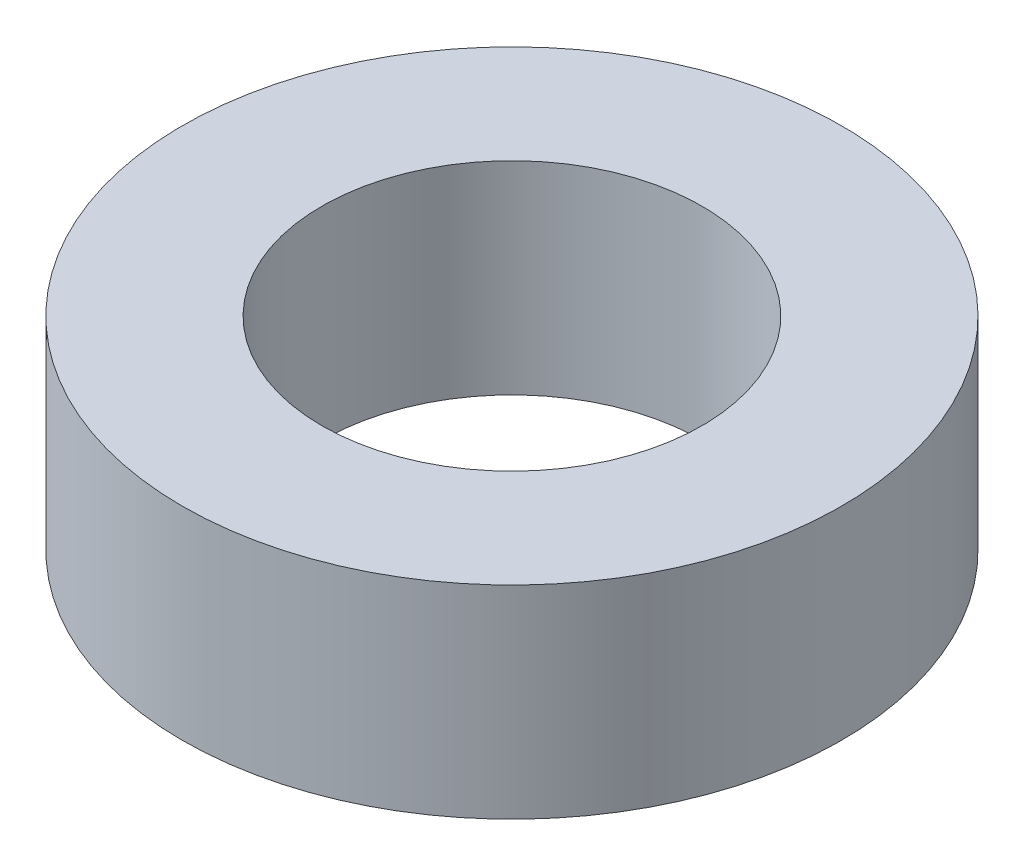
from build123d import *

# Parameters (mm, degrees)
SKETCH1_R           = 26
SKETCH1_R_2         = 15
BOSS_EXTRUDE1_DEPTH = 16


with BuildPart() as part:
    # Sketch1 → Boss-Extrude1 (new body)
    with BuildSketch(Plane(origin=(0, 0, 0), x_dir=(1, 0, 0), z_dir=(0, 1, 0))):
        with Locations(Location((0, 0, 0), (0, 0, 270))):
            Circle(SKETCH1_R)
        with Locations(Location((0, 0, 0), (0, 0, 270))):
            Circle(SKETCH1_R_2, mode=Mode.SUBTRACT)
    extrude(amount=BOSS_EXTRUDE1_DEPTH)


solid = part.part
